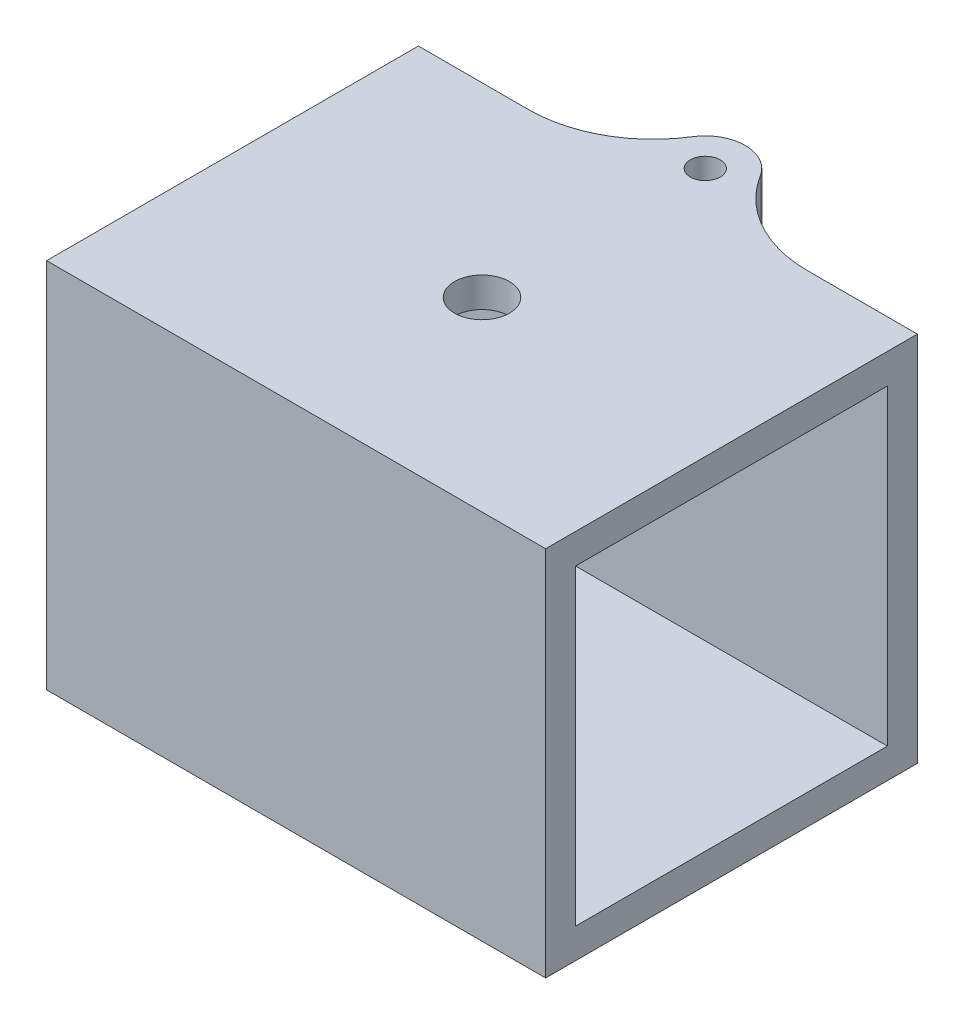
from build123d import *

# Parameters (mm, degrees)
SKETCH_1_W          = 29.8
SKETCH_1_H          = 29.8
SKETCH_1_W_2        = 25
SKETCH_1_H_2        = 25
EXTRUDE_1_DEPTH     = 40
CUT_EXTRUDE_1_REACH = 54.058
SKETCH_4_R          = 2.2
SKETCH_7_R          = 3.2
SKETCH_7_R_2        = 1.2
EXTRUDE_3_DEPTH     = 4
EXTRUDE_START       = -4
SKETCH_8_R          = 3.2
SKETCH_8_R_2        = 1.2
EXTRUDE_4_DEPTH     = 4
FILLET_2_R          = 10


with BuildPart() as part:
    # Эскиз1 → Вытянуть-Тонкостенный1 (new body)
    with BuildSketch(Plane(origin=(0, 0, 0), x_dir=(0, 0, -1), z_dir=(1, 0, 0))):
        Rectangle(SKETCH_1_W, SKETCH_1_H)
        Rectangle(SKETCH_1_W_2, SKETCH_1_H_2, mode=Mode.SUBTRACT)
    extrude(amount=EXTRUDE_1_DEPTH)

    # Эскиз4 → Вырез-Вытянуть1 (cut, up to next)
    with BuildSketch(Plane(origin=(0, 14.9, 0), x_dir=(1, 0, 0), z_dir=(0, 1, 0)), mode=Mode.PRIVATE) as cut_extrude_1_sk1:
        with Locations(Location((20, 0, 0), (0, 0, 270))):
            Circle(SKETCH_4_R)
    cut_extrude_1_tool1 = extrude(cut_extrude_1_sk1.sketch, amount=-CUT_EXTRUDE_1_REACH, mode=Mode.PRIVATE) & part.part
    add(cut_extrude_1_tool1.solids().sort_by_distance((20, 14.9, 0))[0], mode=Mode.SUBTRACT)

    # Эскиз7 → Бобышка-Вытянуть3 (add)
    with BuildSketch(Plane.XZ.offset(14.9)):
        with Locations((20, -17.9)):
            Circle(SKETCH_7_R)
        with Locations(Location((20, -17.9, 0), (0, 0, 270))):
            Circle(SKETCH_7_R_2, mode=Mode.SUBTRACT)
    extrude(amount=-EXTRUDE_3_DEPTH)

    # Эскиз8 → Бобышка-Вытянуть4 (add)
    with BuildSketch(Plane(origin=(0, 14.9, 0), x_dir=(1, 0, 0), z_dir=(0, 1, 0)).offset(EXTRUDE_START)):
        with Locations((20, 17.9)):
            Circle(SKETCH_8_R)
        with Locations(Location((20, 17.9, 0), (0, 0, 90))):
            Circle(SKETCH_8_R_2, mode=Mode.SUBTRACT)
    extrude(amount=EXTRUDE_4_DEPTH)

    # Скругление2
    fillet_2_edges = [part.edges().sort_by_distance(p)[0] for p in [
        (18.886447127, -12.9, -14.9),
        (21.113552873, -12.9, -14.9),
        (21.113552873, 12.9, -14.9),
        (18.886447127, 12.9, -14.9),
    ]]
    fillet(fillet_2_edges, radius=FILLET_2_R)


solid = part.part
